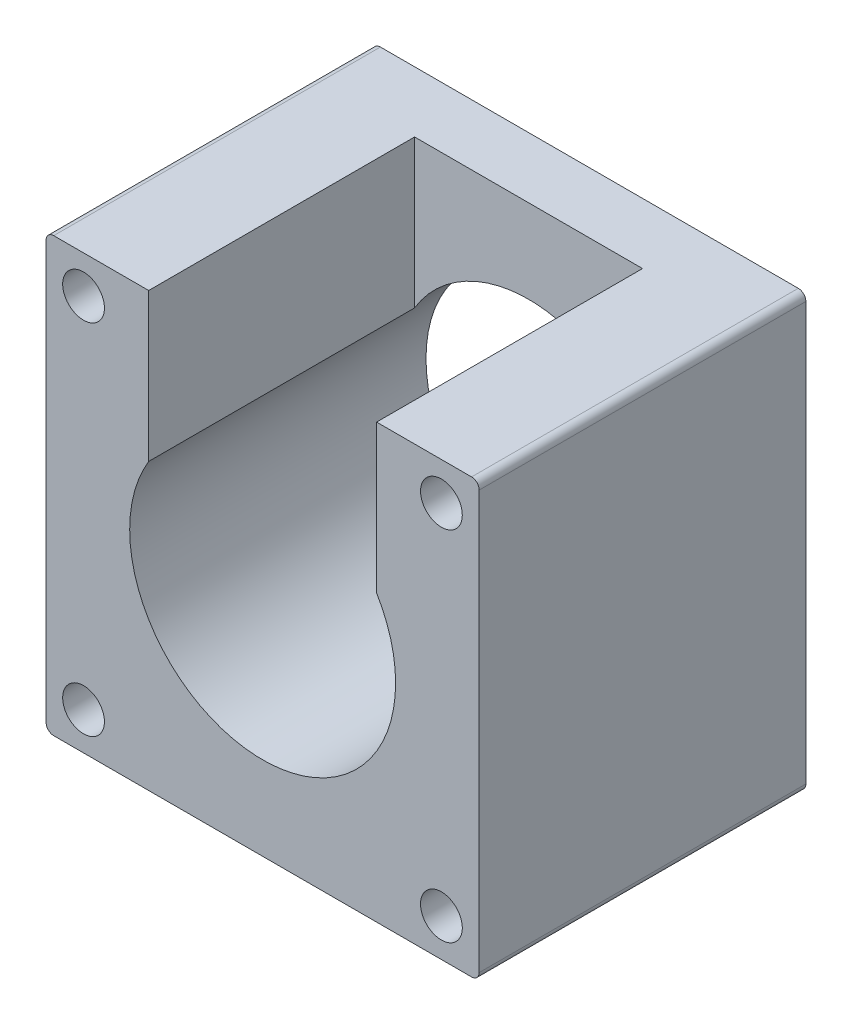
from build123d import *

# Parameters (mm, degrees)
ESQUISSE1_R             = 17.5
ESQUISSE1_R_2           = 2.75
BOSS_EXTRU_1_DEPTH      = 43
ESQUISSE2_W             = 30
ESQUISSE2_H             = 35
ENL_V_MAT_EXTRU_1_DEPTH = 30
ESQUISSE3_R             = 22.5
ENL_V_MAT_EXTRU_2_DEPTH = 4


with BuildPart() as part:
    # Esquisse1 → Boss.-Extru.1 (new body)
    with BuildSketch(Plane.XY):
        with BuildLine():
            Line((1, 0), (56, 0))
            ThreePointArc((56, 0), (56.707106781, 0.292893219), (57, 1))
            Line((57, 1), (57, 56))
            ThreePointArc((57, 56), (56.707106781, 56.707106781), (56, 57))
            Line((56, 57), (1, 57))
            ThreePointArc((1, 57), (0.292893219, 56.707106781), (0, 56))
            Line((0, 56), (0, 1))
            ThreePointArc((0, 1), (0.292893219, 0.292893219), (1, 0))
        make_face()
        with Locations((28.5, 28.5)):
            Circle(ESQUISSE1_R, mode=Mode.SUBTRACT)
        with Locations((4.926655582, 52.073344418)):
            Circle(ESQUISSE1_R_2, mode=Mode.SUBTRACT)
        with Locations((52.026632419, 52.026632419)):
            Circle(ESQUISSE1_R_2, mode=Mode.SUBTRACT)
        with Locations(Location((4.926655582, 4.926655582, 0), (0, 0, 180))):
            Circle(ESQUISSE1_R_2, mode=Mode.SUBTRACT)
        with Locations(Location((52.026632419, 4.973367581, 0), (0, 0, 180))):
            Circle(ESQUISSE1_R_2, mode=Mode.SUBTRACT)
    extrude(amount=BOSS_EXTRU_1_DEPTH)

    # Esquisse2 → Enlèv. mat.-Extru.1 (cut)
    with BuildSketch(Plane(origin=(0, 57, 0), x_dir=(1, 0, 0), z_dir=(0, 1, 0))):
        with Locations((28.5, -25.5)):
            Rectangle(ESQUISSE2_W, ESQUISSE2_H)
    extrude(amount=-ENL_V_MAT_EXTRU_1_DEPTH, mode=Mode.SUBTRACT)

    # Esquisse3 → Enlèv. mat.-Extru.2 (cut)
    with BuildSketch(Plane(origin=(0, 0, 0), x_dir=(-1, 0, 0), z_dir=(0, 0, -1))):
        with Locations((-28.5, 28.5)):
            Circle(ESQUISSE3_R)
    extrude(amount=-ENL_V_MAT_EXTRU_2_DEPTH, mode=Mode.SUBTRACT)


solid = part.part
